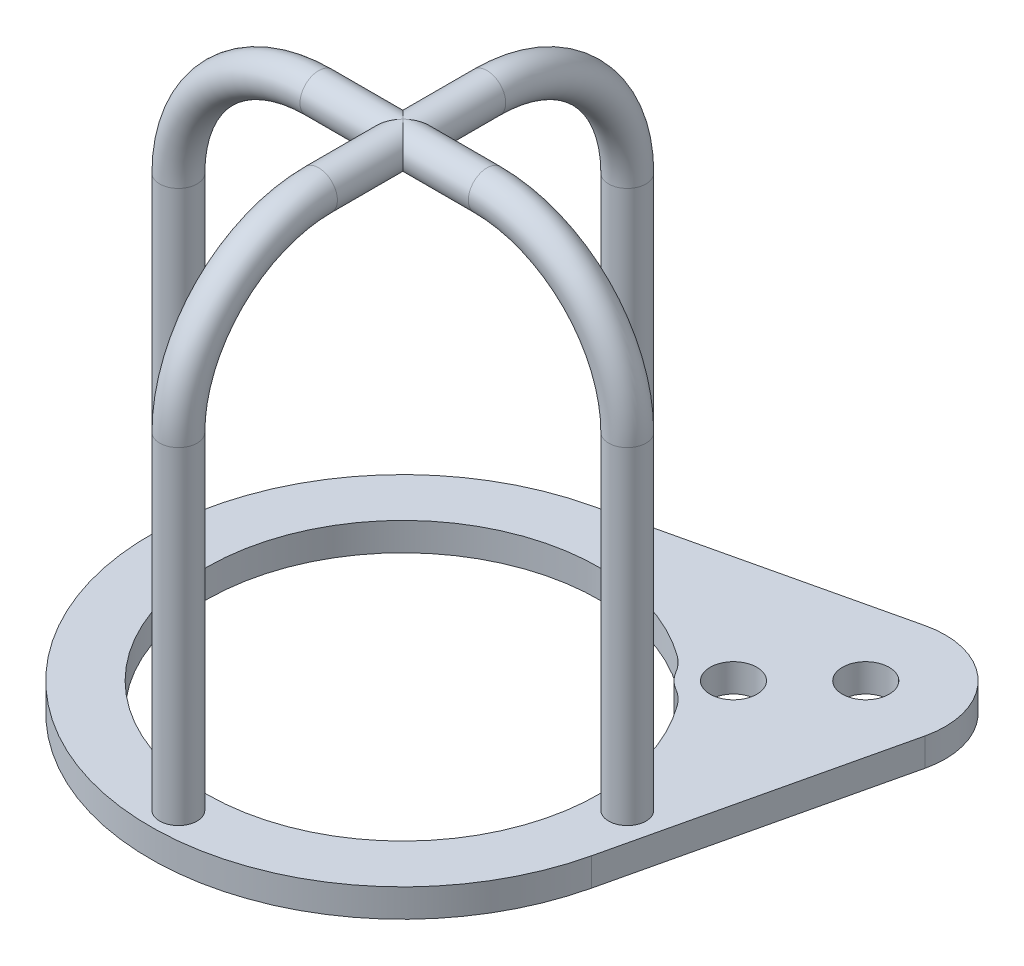
from build123d import *

# Parameters (mm, degrees)
ESQUISSE2_R                  = 2
R_P_TITION_CIRCULAIRE1_COUNT = 4
ESQUISSE4_R                  = 2.5
BOSS_EXTRU_1_DEPTH           = 3
CONG_1_R                     = 5


with BuildPart() as part:
    # Balayage1: sweep along a path in Esquisse1
    with BuildLine(Plane.XY) as balayage1_path:
        Line((0, 50), (9, 50))
        ThreePointArc((9, 50), (19.606601718, 45.606601718), (24, 35))
        Line((24, 35), (24, 0))
    # Esquisse2 → Balayage1 (sweep)
    with BuildSketch(Plane(origin=(0, 0, 0), x_dir=(1, 0, 0), z_dir=(0, 1, 0))):
        with Locations((24, 0)):
            Circle(ESQUISSE2_R)
    balayage1 = sweep(path=balayage1_path.line)

    # Répétition circulaire1: Balayage1 ×4 about axis
    r_p_tition_circulaire1_axis = Axis((0, 0, 0), (0, 1, 0))
    for i in range(1, R_P_TITION_CIRCULAIRE1_COUNT):
        add(balayage1.rotate(r_p_tition_circulaire1_axis, i * 360 / R_P_TITION_CIRCULAIRE1_COUNT))

    # Esquisse4 → Boss.-Extru.1 (add)
    with BuildSketch(Plane.XZ):
        with BuildLine():
            Line((26.298310212, 6.115462371), (33.027835001, -22.823499188))
            ThreePointArc((33.027835001, -22.823499188), (30.759144982, -30.759144982), (22.823499188, -33.027835001))
            Line((22.823499188, -33.027835001), (-6.115462371, -26.298310212))
            ThreePointArc((-6.115462371, -26.298310212), (-19.091883092, 19.091883092), (26.298310212, 6.115462371))
        make_face()
        with Locations((17.67766953, -17.67766953)):
            Circle(ESQUISSE4_R, mode=Mode.SUBTRACT)
        with Locations((24.748737342, -24.748737342)):
            Circle(ESQUISSE4_R, mode=Mode.SUBTRACT)
        with BuildLine():
            ThreePointArc((13.454452036, -16.123824621), (14.495689014, -14.495689014), (16.123824621, -13.454452036))
            ThreePointArc((16.123824621, -13.454452036), (-14.849242405, 14.849242405), (13.454452036, -16.123824621))
        make_face(mode=Mode.SUBTRACT)
    extrude(amount=BOSS_EXTRU_1_DEPTH)

    # Congé1
    cong_1_edges = [part.edges().sort_by_distance(p)[0] for p in [
        (13.454452036, -1.5, -16.123824621),
        (16.123824621, -1.5, -13.454452036),
    ]]
    fillet(cong_1_edges, radius=CONG_1_R)


solid = part.part
